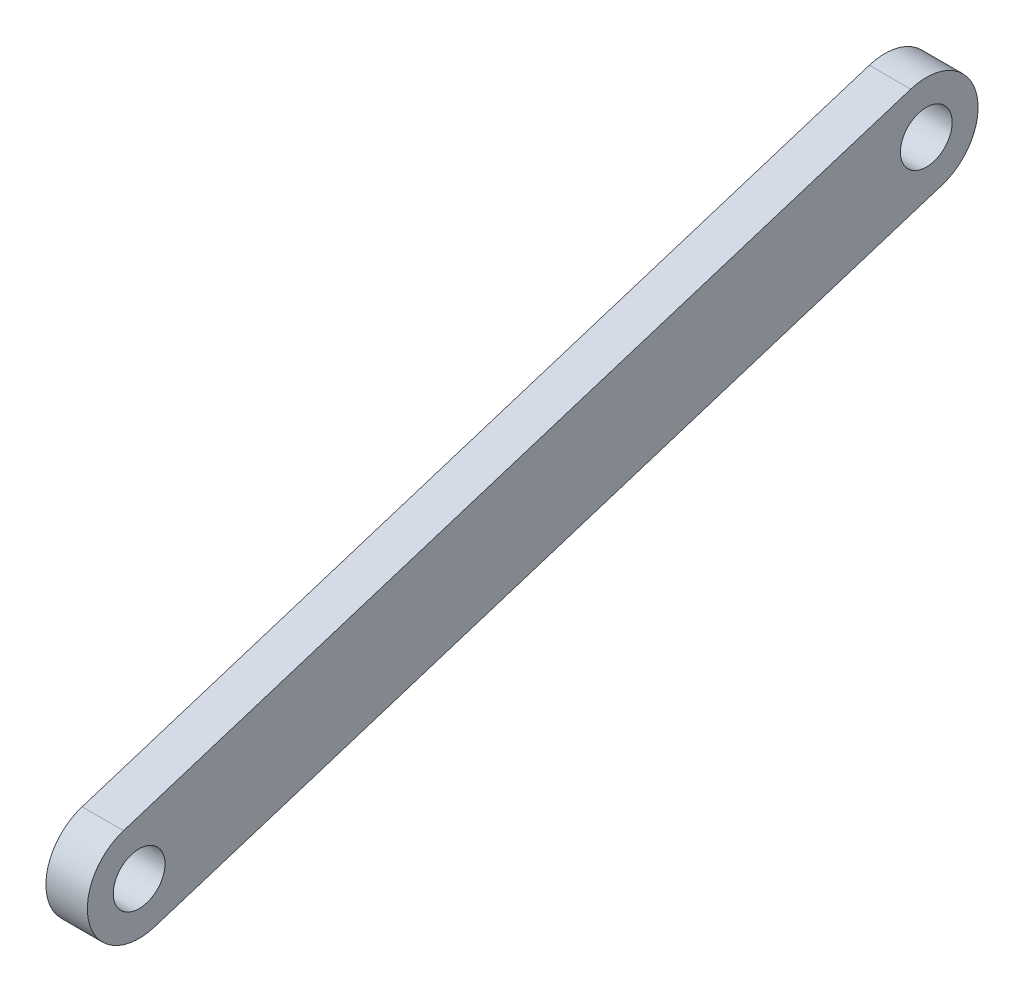
from build123d import *

# Parameters (mm, degrees)
SKETCH2_R           = 31.25
BOSS_EXTRUDE1_DEPTH = 50


with BuildPart() as part:
    # Sketch2 → Boss-Extrude1 (new body)
    with BuildSketch(Plane(origin=(0, 0, 0), x_dir=(0, 0, -1), z_dir=(1, 0, 0))):
        with BuildLine():
            Line((-18.820710496, 59.598916571), (931.179289504, 359.598916571))
            ThreePointArc((931.179289504, 359.598916571), (1009.598916571, 318.820710496), (968.820710496, 240.401083429))
            Line((968.820710496, 240.401083429), (18.820710496, -59.598916571))
            ThreePointArc((18.820710496, -59.598916571), (-59.598916571, -18.820710496), (-18.820710496, 59.598916571))
        make_face()
        Circle(SKETCH2_R, mode=Mode.SUBTRACT)
        with Locations((950, 300)):
            Circle(SKETCH2_R, mode=Mode.SUBTRACT)
    extrude(amount=BOSS_EXTRUDE1_DEPTH)


solid = part.part
